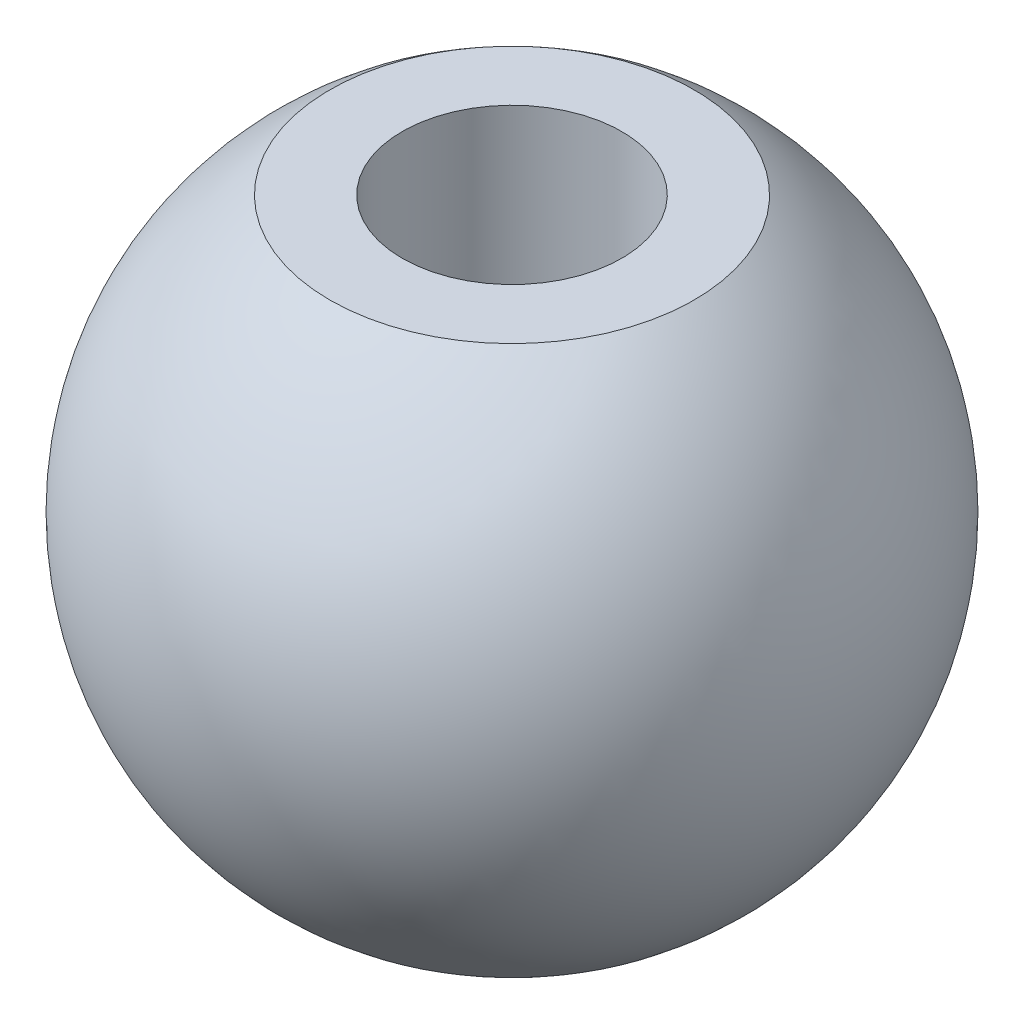
from build123d import *

# Parameters (mm, degrees)
SKETCH_2_R          = 2
CUT_EXTRUDE_1_DEPTH = 10
SKETCH_3_R          = 1
CUT_EXTRUDE_2_DEPTH = 10


with BuildPart() as part:
    # 草图1 → 旋转4 (revolve)
    with BuildSketch(Plane(origin=(0, 0, 0), x_dir=(1, 0, 0), z_dir=(0, 1, 0))):
        with BuildLine():
            Line((0, 3), (0, -3))
            ThreePointArc((0, -3), (-3, 0), (0, 3))
        make_face()
    revolve(axis=Axis((0, 0, -3), (0, 0, 1)))

    # 草图2 → 切除-拉伸1 (cut)
    with BuildSketch(Plane(origin=(0, 2.5, 0), x_dir=(1, 0, 0), z_dir=(0, 1, 0))):
        Circle(SKETCH_2_R)
    cut_extrude_1 = extrude(amount=CUT_EXTRUDE_1_DEPTH, mode=Mode.SUBTRACT)

    # 草图3 → 切除-拉伸2 (cut)
    with BuildSketch(Plane(origin=(0, 2.5, 0), x_dir=(1, 0, 0), z_dir=(0, 1, 0))):
        with Locations(Location((0, 0, 0), (0, 0, 270))):
            Circle(SKETCH_3_R)
    extrude(amount=-CUT_EXTRUDE_2_DEPTH, mode=Mode.SUBTRACT)

    # 镜向1: 切除-拉伸1 across plane
    add(cut_extrude_1.mirror(Plane.ZX), mode=Mode.SUBTRACT)


solid = part.part
